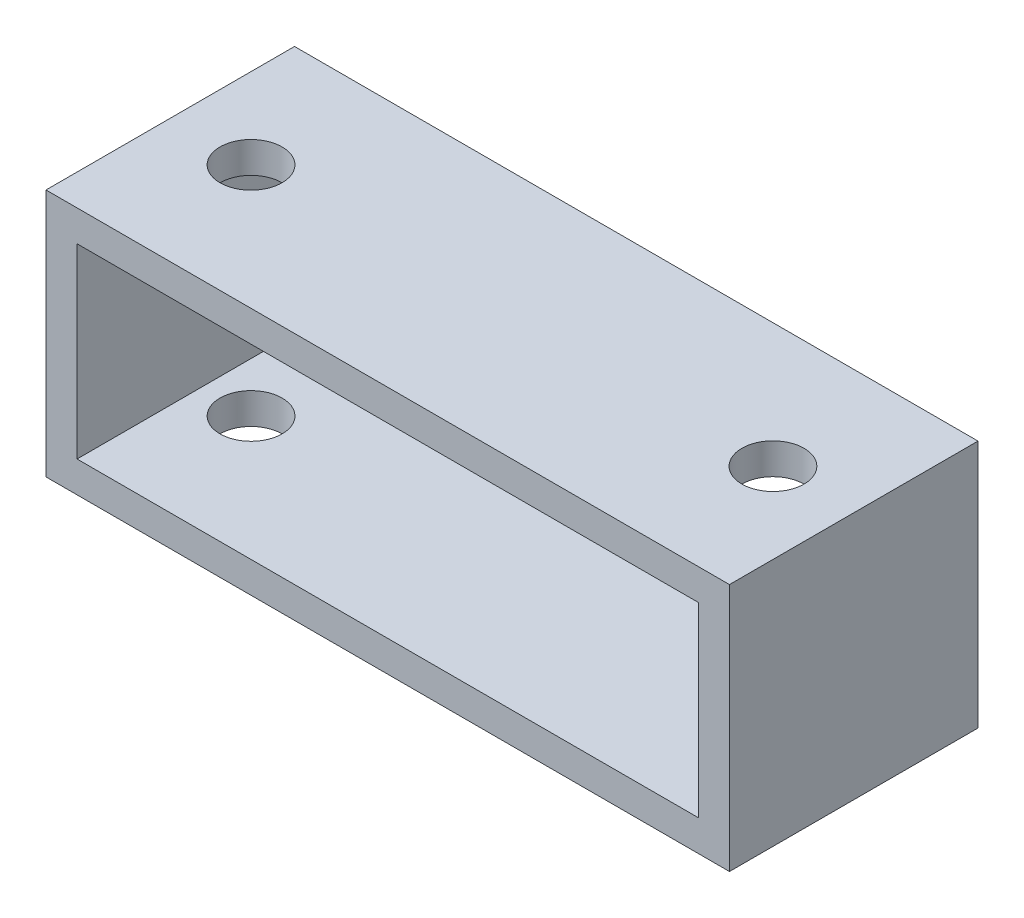
from build123d import *

# Parameters (mm, degrees)
SKETCH_1_W          = 55
SKETCH_1_H          = 20
EXTRUDE_1_DEPTH     = 20
CUT_EXTRUDE_1_REACH = 41.449
SKETCH_2_W          = 50
SKETCH_2_H          = 15
CUT_EXTRUDE_2_REACH = 37.444
SKETCH_3_R          = 2.5


with BuildPart() as part:
    # 草图1 → 凸台-拉伸1 (new body)
    with BuildSketch(Plane(origin=(0, 0, 0), x_dir=(1, 0, 0), z_dir=(0, 1, 0))):
        Rectangle(SKETCH_1_W, SKETCH_1_H)
    extrude(amount=EXTRUDE_1_DEPTH)

    # 草图2 → 切除-拉伸1 (cut, up to next)
    with BuildSketch(Plane.XY.offset(10), mode=Mode.PRIVATE) as cut_extrude_1_sk1:
        with Locations((0, 10)):
            Rectangle(SKETCH_2_W, SKETCH_2_H)
    cut_extrude_1_tool1 = extrude(cut_extrude_1_sk1.sketch, amount=-CUT_EXTRUDE_1_REACH, mode=Mode.PRIVATE) & part.part
    add(cut_extrude_1_tool1.solids().sort_by_distance((0, 10, 10))[0], mode=Mode.SUBTRACT)

    # 切除-拉伸2: up to this face of the body (flat: up to its plane)
    cut_extrude_2_end = Plane(part.part.faces().sort_by_distance((0, 0, 0))[0])
    # 草图3 → 切除-拉伸2 (cut, up to the picked face)
    with BuildSketch(Plane(origin=(0, 20, 0), x_dir=(1, 0, 0), z_dir=(0, 1, 0)), mode=Mode.PRIVATE) as cut_extrude_2_sk1:
        with Locations(Location((-21, 0, 0), (0, 0, 270))):
            Circle(SKETCH_3_R)
    cut_extrude_2_tool1 = split(extrude(cut_extrude_2_sk1.sketch, amount=-CUT_EXTRUDE_2_REACH, mode=Mode.PRIVATE), bisect_by=cut_extrude_2_end, keep=Keep.BOTH, mode=Mode.PRIVATE)
    # 草图3 → 切除-拉伸2 (cut, up to the picked face)
    with BuildSketch(Plane(origin=(0, 20, 0), x_dir=(1, 0, 0), z_dir=(0, 1, 0)), mode=Mode.PRIVATE) as cut_extrude_2_sk2:
        with Locations(Location((21, 0, 0), (0, 0, 270))):
            Circle(SKETCH_3_R)
    cut_extrude_2_tool2 = split(extrude(cut_extrude_2_sk2.sketch, amount=-CUT_EXTRUDE_2_REACH, mode=Mode.PRIVATE), bisect_by=cut_extrude_2_end, keep=Keep.BOTH, mode=Mode.PRIVATE)
    add(cut_extrude_2_tool1.solids().sort_by(Axis((-21, 20, 0), (0, -1, 0)))[0], mode=Mode.SUBTRACT)
    add(cut_extrude_2_tool2.solids().sort_by(Axis((21, 20, 0), (0, -1, 0)))[0], mode=Mode.SUBTRACT)


solid = part.part
